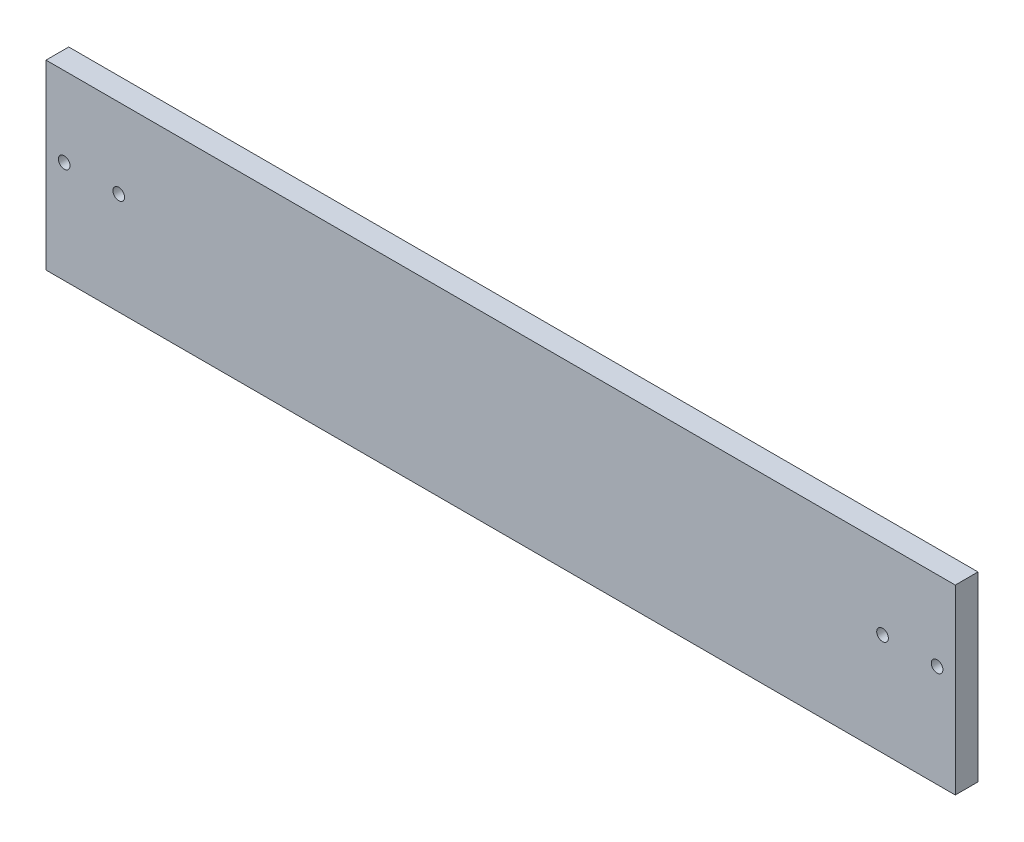
from build123d import *

# Parameters (mm, degrees)
SKETCH1_W             = 254
SKETCH1_H             = 50.8
BOSS_EXTRUDE1_DEPTH   = 6.35
F_4_CLEARANCE_HOLE1_D = 3.2512
F_4_CLEARANCE_HOLE2_D = 3.2512


with BuildPart() as part:
    # Sketch1 → Boss-Extrude1 (new body)
    with BuildSketch(Plane.XY):
        Rectangle(SKETCH1_W, SKETCH1_H)
    extrude(amount=BOSS_EXTRUDE1_DEPTH)

    # #4 Clearance Hole1 (through all)
    with Locations(Plane.XY.offset(6.35)):
        with Locations((-121.92, 3.175), (-106.68, 3.175)):
            Hole(F_4_CLEARANCE_HOLE1_D / 2)

    # #4 Clearance Hole2 (through all)
    with Locations(Plane.XY.offset(6.35)):
        with Locations((121.92, 3.175), (106.68, 3.175)):
            Hole(F_4_CLEARANCE_HOLE2_D / 2)


solid = part.part
